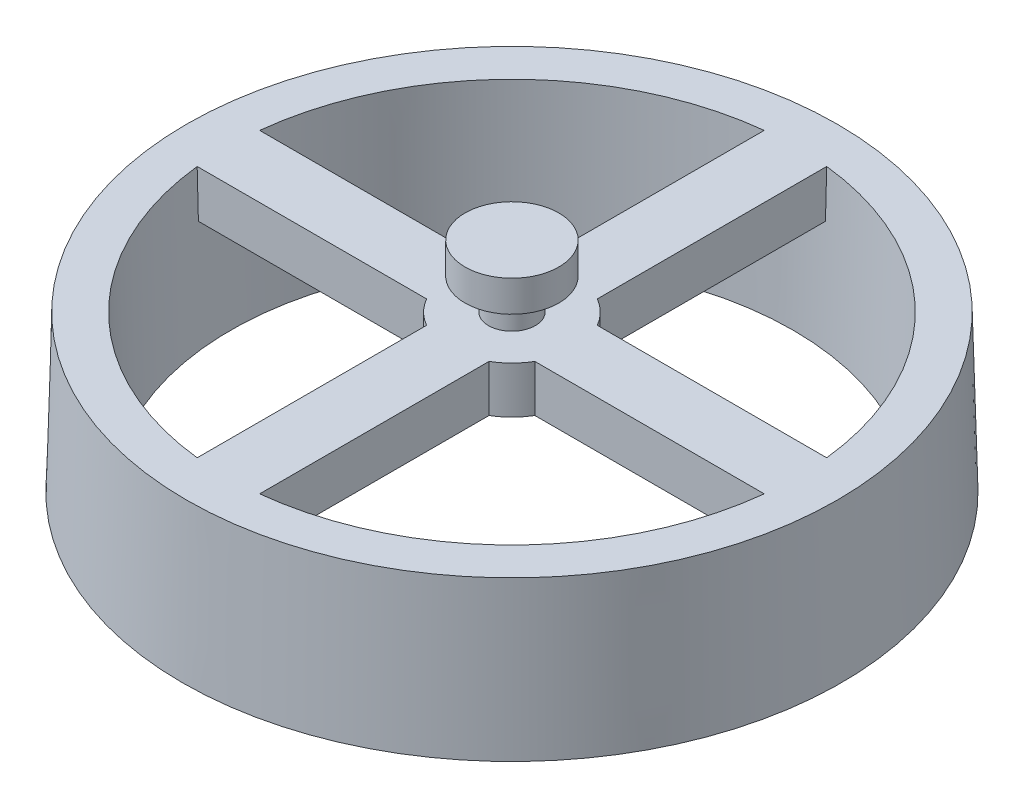
from build123d import *

# Parameters (mm, degrees)
SKETCH1_R         = 10.55
SKETCH1_R_2       = 9
EXTRUDE1_DEPTH    = 5
EXTRUDE1_DRAFT    = 1.5
EXTRUDE3_DEPTH    = 1.5
CIRPATTERN1_COUNT = 4
SKETCH5_R         = 0.75
EXTRUDE4_DEPTH    = 1
SKETCH6_R         = 1.5
EXTRUDE5_DEPTH    = 1


with BuildPart() as part:
    # Sketch1 → Extrude1 (with draft: the straight prism first)
    with BuildSketch(Plane(origin=(0, 0, 0), x_dir=(1, 0, 0), z_dir=(0, 1, 0))):
        Circle(SKETCH1_R)
        Circle(SKETCH1_R_2, mode=Mode.SUBTRACT)
    extrude(amount=EXTRUDE1_DEPTH)
    # Extrude1: the draft: its side faces are tilted about the plane it starts from
    extrude1_sides = [part.faces().sort_by_distance(p)[0] for p in [
        (-10.55, 2.5, 0),
        (-9, 2.5, 0),
    ]]
    draft(extrude1_sides, Plane(origin=(0, 0, 0), x_dir=(1, 0, 0), z_dir=(0, 1, 0)), EXTRUDE1_DRAFT)

    # Sketch4 → Extrude3 (add)
    with BuildSketch(Plane(origin=(0, 5, 0), x_dir=(1, 0, 0), z_dir=(0, 1, 0))):
        with BuildLine():
            Line((-1, 9.5), (1, 9.5))
            Line((1, 9.5), (1, 1.732050808))
            ThreePointArc((1, 1.732050808), (0, -2), (-1, 1.732050808))
            Line((-1, 1.732050808), (-1, 9.5))
        make_face()
    extrude3 = extrude(amount=-EXTRUDE3_DEPTH)

    # CirPattern1: Extrude3 ×4 about axis
    cirpattern1_axis = Axis((0, 5.25, 0), (0, -1, 0))
    for i in range(1, CIRPATTERN1_COUNT):
        add(extrude3.rotate(cirpattern1_axis, i * 360 / CIRPATTERN1_COUNT))

    # Sketch5 → Extrude4 (add)
    with BuildSketch(Plane(origin=(0, 5, 0), x_dir=(1, 0, 0), z_dir=(0, 1, 0))):
        Circle(SKETCH5_R)
    extrude(amount=EXTRUDE4_DEPTH)

    # Sketch6 → Extrude5 (add)
    with BuildSketch(Plane(origin=(0, 6, 0), x_dir=(1, 0, 0), z_dir=(0, 1, 0))):
        Circle(SKETCH6_R)
    extrude(amount=EXTRUDE5_DEPTH)


solid = part.part
